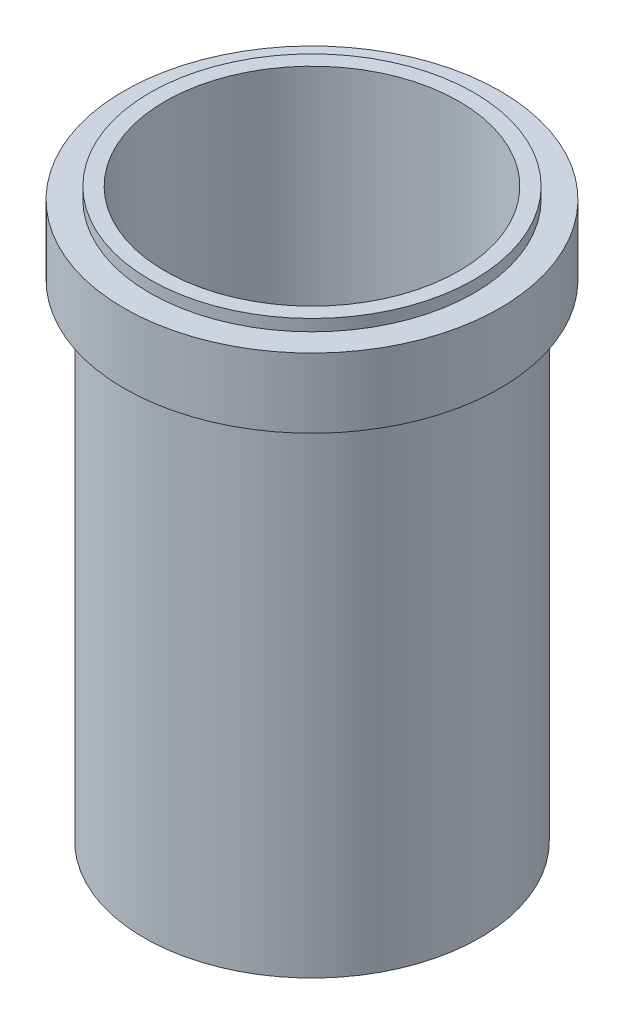
from build123d import *


with BuildPart() as part:
    # Esquisse1 → Révolution1 (revolve)
    with BuildSketch(Plane.XY, mode=Mode.PRIVATE) as r_volution1_sk:
        Polygon((25.4, 113.306213316), (25.4, 15.306213316), (29, 15.306213316), (29, 99.306213316), (32.5, 99.306213316), (32.5, 111.306213316), (28, 111.306213316), (28, 113.306213316), align=None)
    revolve(r_volution1_sk.sketch.rotate(Axis((0, 0, 0), (0, 1, 0)), 90), axis=Axis((0, 0, 0), (0, 1, 0)))


solid = part.part
